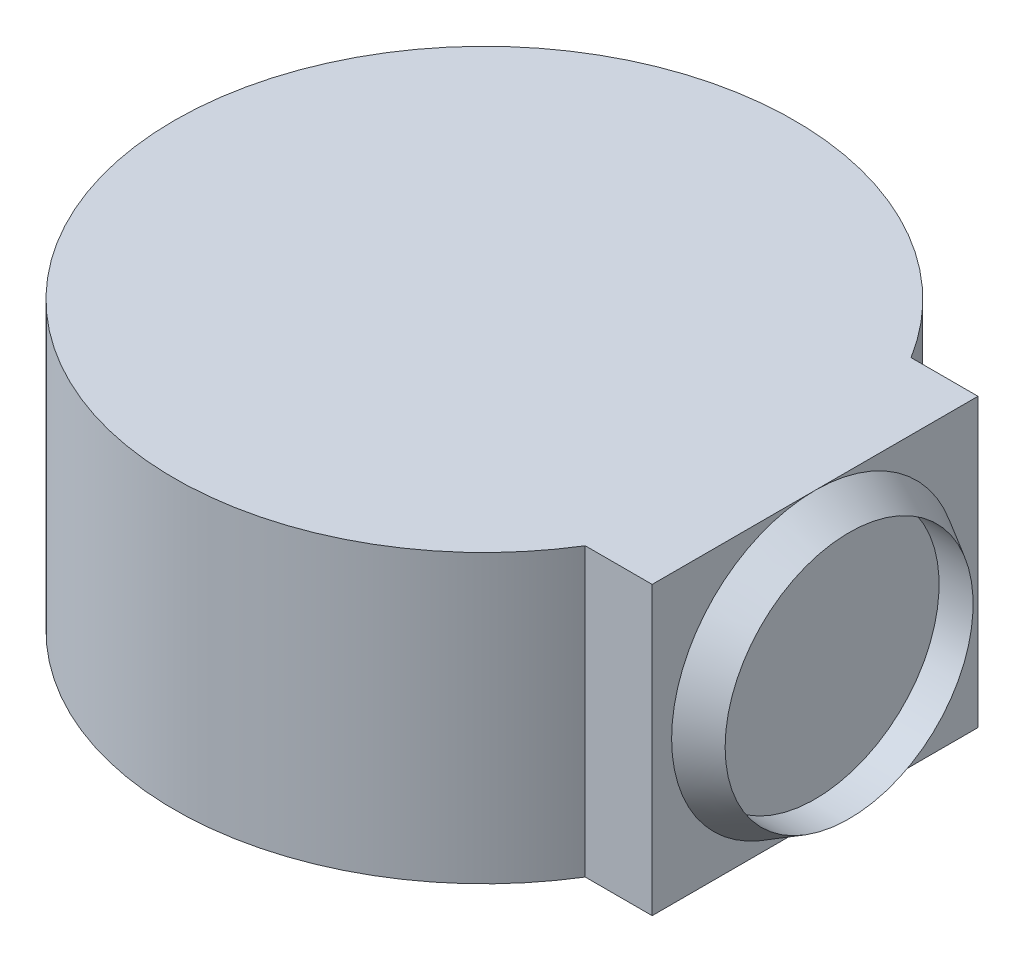
from build123d import *

# Parameters (mm, degrees)
SKETCH1_R           = 159.375
BOSS_EXTRUDE1_DEPTH = 147.5
SKETCH2_W           = 167.5
SKETCH2_H           = 147.5
BOSS_EXTRUDE2_DEPTH = 170
SKETCH5_R           = 132.8125
BOSS_EXTRUDE3_DEPTH = 10


with BuildPart() as part:
    # Sketch1 → Boss-Extrude1 (new body)
    with BuildSketch(Plane(origin=(0, 0, 0), x_dir=(1, 0, 0), z_dir=(0, 1, 0))):
        with Locations(Location((0, 0, 0), (0, 0, 270))):
            Circle(SKETCH1_R)
    extrude(amount=BOSS_EXTRUDE1_DEPTH)

    # Sketch2 → Boss-Extrude2 (add)
    with BuildSketch(Plane(origin=(0, 0, 0), x_dir=(0, 0, -1), z_dir=(1, 0, 0))):
        with Locations((0, 73.75)):
            Rectangle(SKETCH2_W, SKETCH2_H)
    extrude(amount=BOSS_EXTRUDE2_DEPTH)

    # Sketch4 → Revolve1 (revolve)
    with BuildSketch(Plane.XY, mode=Mode.PRIVATE) as revolve1_sk:
        Polygon((170, 0), (170, 10), (187.5, 10), align=None)
    revolve(revolve1_sk.sketch.rotate(Axis((170, 73.75, 0), (1, 0, 0)), 270), axis=Axis((170, 73.75, 0), (1, 0, 0)))

    # Sketch5 → Boss-Extrude3 (add)
    with BuildSketch(Plane(origin=(0, 0, 0), x_dir=(-1, 0, 0), z_dir=(0, -1, 0))):
        with Locations(Location((0, 0, 0), (0, 0, 270))):
            Circle(SKETCH5_R)
    extrude(amount=BOSS_EXTRUDE3_DEPTH)


solid = part.part
